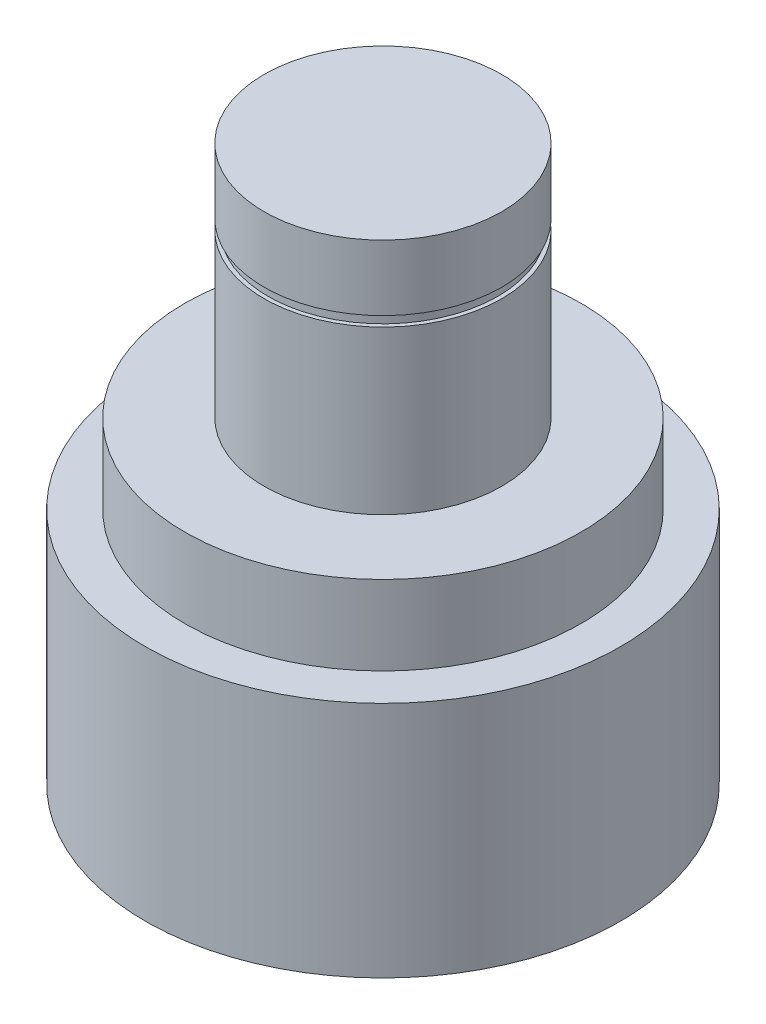
from build123d import *


with BuildPart() as part:
    # Sketch1 → Revolve1 (revolve)
    with BuildSketch(Plane.XY):
        Polygon((0, 0), (-6, 0), (-6, 6), (-5, 6), (-5, 8), (-3, 8), (-3, 12.1), (-2.9, 12.1), (-2.9, 12.35), (-3, 12.35), (-3, 14), (0, 14), align=None)
    revolve(axis=Axis((0, 14, 0), (0, -1, 0)))


solid = part.part
